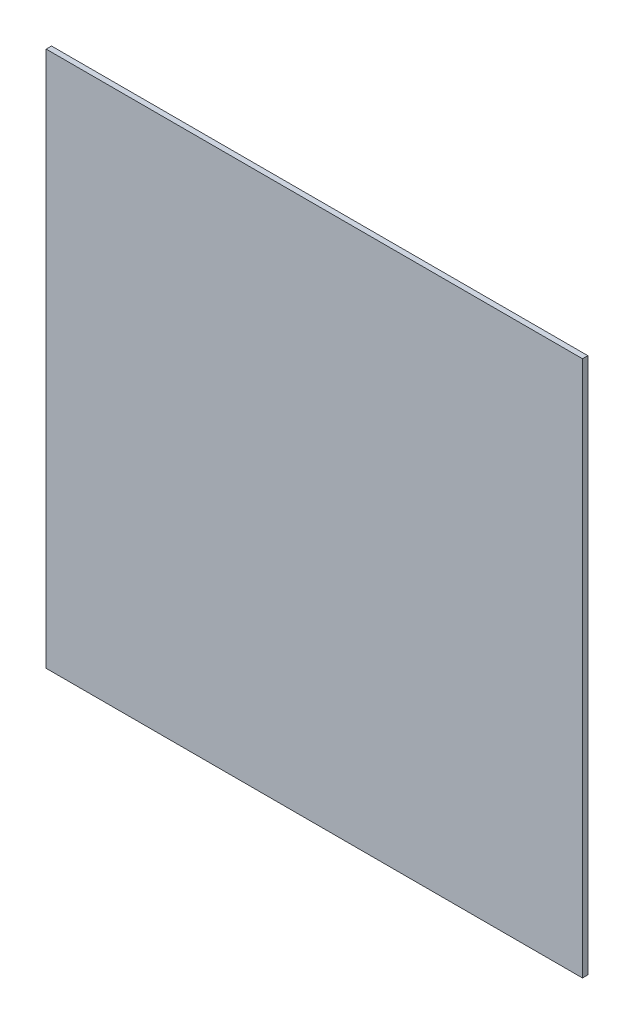
from build123d import *

# Parameters (mm, degrees)
SKETCH1_W           = 300
SKETCH1_H           = 300
BOSS_EXTRUDE1_DEPTH = 3


with BuildPart() as part:
    # Sketch1 → Boss-Extrude1 (new body)
    with BuildSketch(Plane.XY):
        with Locations((70.782531589, -73.342939481)):
            Rectangle(SKETCH1_W, SKETCH1_H)
    extrude(amount=BOSS_EXTRUDE1_DEPTH)


solid = part.part
